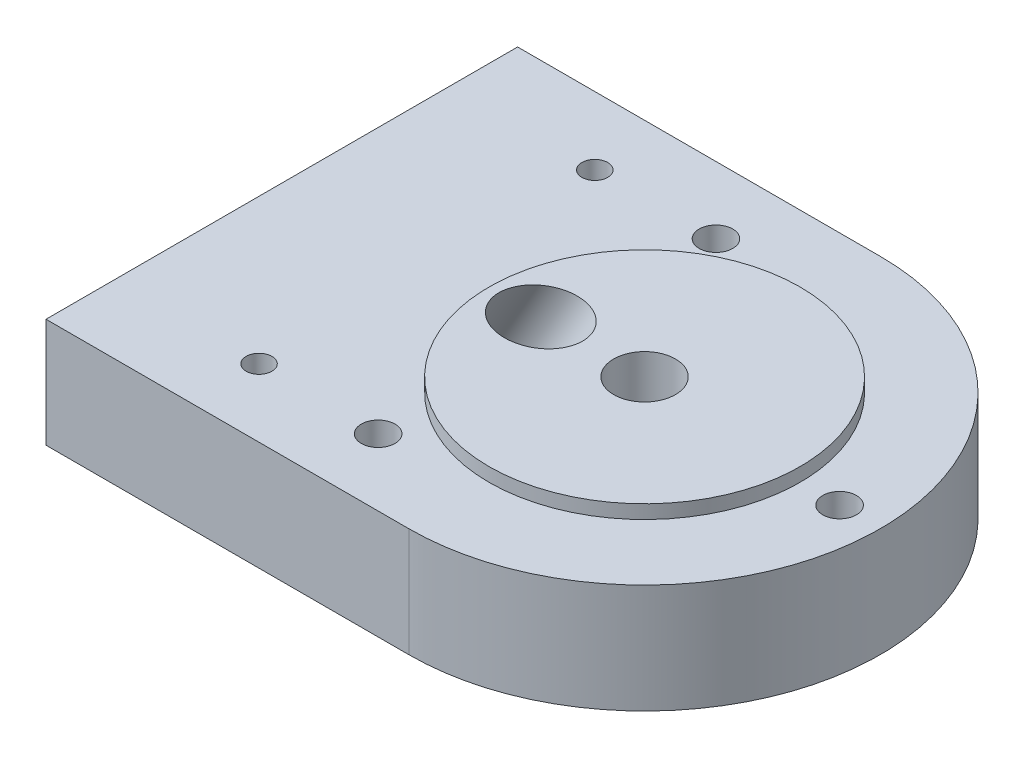
from build123d import *

# Parameters (mm, degrees)
BOSS_EXTRUDE1_DEPTH               = 9.5504
SKETCH2_R                         = 13.6144
BOSS_EXTRUDE2_DEPTH               = 1.1938
SKETCH3_R                         = 1.4732
CUT_EXTRUDE1_DEPTH                = 68.553783128
F_4_40_TAPPED_HOLE1_D             = 2.2606
F_1_4_28_TAPPED_HOLE1_D           = 5.4102
F_1_4_28_TAPPED_HOLE1_CSINK_D     = 7.366
F_1_4_28_TAPPED_HOLE1_CSINK_ANGLE = 82
SKETCH11_R                        = 3.175
CUT_EXTRUDE3_DEPTH                = 68.553783128
SKETCH12_R                        = 3.175
CUT_EXTRUDE4_DEPTH                = 3.175
LPATTERN1_COUNT                   = 2
LPATTERN1_PITCH                   = 15.875


with BuildPart() as part:
    # Sketch1 → Boss-Extrude1 (new body)
    with BuildSketch(Plane(origin=(0, 0, 0), x_dir=(1, 0, 0), z_dir=(0, 1, 0))):
        with BuildLine():
            Line((0, 0), (31.75, 0))
            ThreePointArc((31.75, 0), (52.3875, 20.6375), (31.75, 41.275))
            Line((31.75, 41.275), (0, 41.275))
            Line((0, 41.275), (0, 0))
        make_face()
    extrude(amount=BOSS_EXTRUDE1_DEPTH)

    # Sketch2 → Boss-Extrude2 (add)
    with BuildSketch(Plane(origin=(0, 9.5504, 0), x_dir=(1, 0, 0), z_dir=(0, 1, 0))):
        with Locations(Location((31.75, 20.6375, 0), (0, 0, 270))):
            Circle(SKETCH2_R)
    extrude(amount=BOSS_EXTRUDE2_DEPTH)

    # Sketch3 → Cut-Extrude1 (cut, through all)
    with BuildSketch(Plane(origin=(0, 10.7442, 0), x_dir=(1, 0, 0), z_dir=(0, 1, 0))):
        with Locations(Location((23.2156, 35.4203, 0), (0, 0, 270))):
            Circle(SKETCH3_R)
        with Locations(Location((48.8188, 20.6375, 0), (0, 0, 270))):
            Circle(SKETCH3_R)
        with Locations(Location((23.2156, 5.8547, 0), (0, 0, 270))):
            Circle(SKETCH3_R)
    extrude(amount=-CUT_EXTRUDE1_DEPTH, mode=Mode.SUBTRACT)

    # #4-40 Tapped Hole1 (through all)
    with Locations(Plane(origin=(0, 0, 0), x_dir=(-1, 0, 0), z_dir=(0, -1, 0))):
        with Locations((-12.7, 5.9436), (-12.7, 35.3314)):
            Hole(F_4_40_TAPPED_HOLE1_D / 2)

    # 1/4-28 Tapped Hole1 (through all)
    with Locations(Plane(origin=(0, 0, 0), x_dir=(-1, 0, 0), z_dir=(0, -1, 0))):
        with Locations((-31.75, 20.6375)):
            CounterSinkHole(F_1_4_28_TAPPED_HOLE1_D / 2, F_1_4_28_TAPPED_HOLE1_CSINK_D / 2, counter_sink_angle=F_1_4_28_TAPPED_HOLE1_CSINK_ANGLE)

    # Sketch11 → Cut-Extrude3 (cut, through all)
    with BuildSketch(Plane(origin=(0, 0, 0), x_dir=(0, 0, 1), z_dir=(0.499999999999998, 0.8660254037844398, 0))):
        with Locations(Location((-20.6375, 14.25807156, 0), (0, 0, 270))):
            Circle(SKETCH11_R)
    extrude(amount=CUT_EXTRUDE3_DEPTH, mode=Mode.SUBTRACT)

    # Sketch12 → Cut-Extrude4 (cut)
    with BuildSketch(Plane.XZ):
        with Locations(Location((31.75, -20.6375, 0), (0, 0, 270))):
            Circle(SKETCH12_R)
    extrude(amount=-CUT_EXTRUDE4_DEPTH, mode=Mode.SUBTRACT)

    # Sketch15 → #6-32 Tapped Hole1 (revolve, cut)
    with BuildSketch(Plane(origin=(0, 4.7752, -28.575), x_dir=(0, 0, 1), z_dir=(0, 1, 0))):
        Polygon((0, 0), (0, 10.33769403), (1.35255, 9.525), (1.35255, 0), align=None)
    f_6_32_tapped_hole1 = revolve(axis=Axis((-6.35, 4.7752, -28.575), (1, 0, 0)), mode=Mode.SUBTRACT)

    # LPattern1: #6-32 Tapped Hole1 ×2
    with Locations(*[(0, 0, i * LPATTERN1_PITCH) for i in range(1, LPATTERN1_COUNT)]):
        add(f_6_32_tapped_hole1, mode=Mode.SUBTRACT)


solid = part.part
